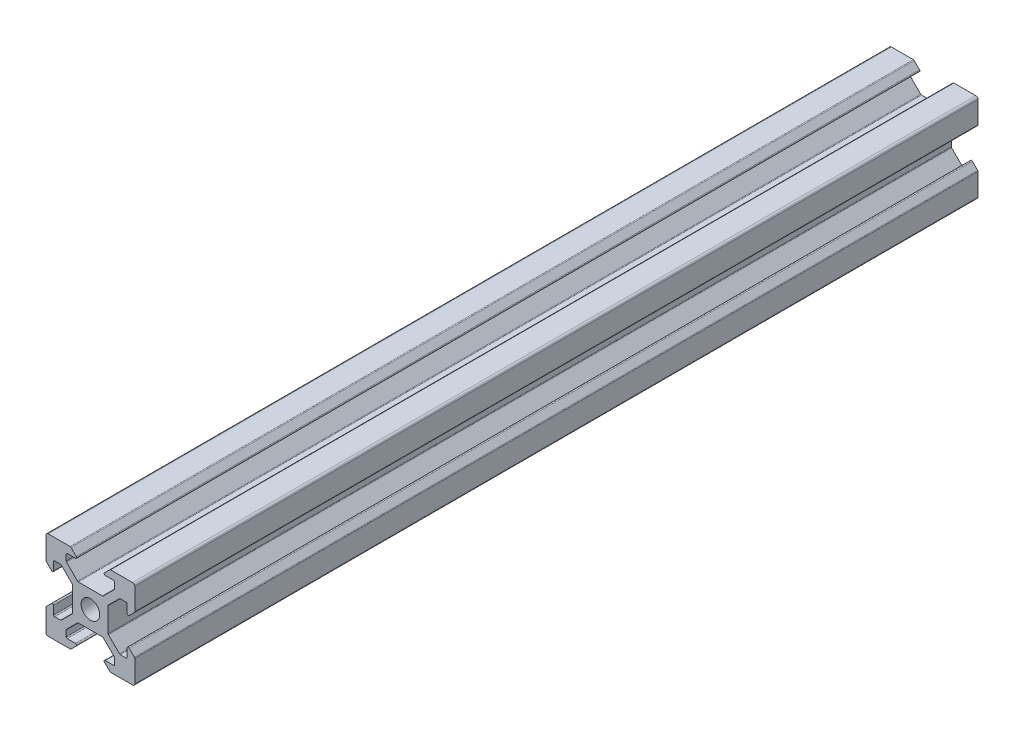
from build123d import *

# Parameters (mm, degrees)
MODEL_R             = 2.1
BOSS_EXTRUDE1_DEPTH = 190


with BuildPart() as part:
    # Model → Boss-Extrude1 (new body)
    with BuildSketch(Plane.XY):
        with BuildLine():
            Line((2012.931211125, 1381.800393717), (2012.931211125, 1378.200393717))
            Line((2012.931211125, 1378.200393717), (2012.931211125, 1377.300429431))
            ThreePointArc((2012.931211125, 1377.300429431), (2012.908374985, 1377.185624401), (2012.843343159, 1377.088297396))
            Line((2012.843343159, 1377.088297396), (2010.378662785, 1374.623617022))
            ThreePointArc((2010.378662785, 1374.623617022), (2010.297556948, 1374.569423834), (2010.20188609, 1374.550393717))
            Line((2010.20188609, 1374.550393717), (2008.881211125, 1374.550393717))
            ThreePointArc((2008.881211125, 1374.550393717), (2008.70443443, 1374.623617022), (2008.631211125, 1374.800393717))
            Line((2008.631211125, 1374.800393717), (2008.631211125, 1376.650393717))
            ThreePointArc((2008.631211125, 1376.650393717), (2008.476881983, 1376.8813636), (2008.20443443, 1376.827170412))
            Line((2008.20443443, 1376.827170412), (2007.01907909, 1375.641815073))
            ThreePointArc((2007.01907909, 1375.641815073), (2006.954047265, 1375.544488069), (2006.931211125, 1375.429683039))
            Line((2006.931211125, 1375.429683039), (2006.931211125, 1370.500393717))
            ThreePointArc((2006.931211125, 1370.500393717), (2007.077657734, 1370.146840327), (2007.431211125, 1370.000393717))
            Line((2007.431211125, 1370.000393717), (2012.360500447, 1370.000393717))
            ThreePointArc((2012.360500447, 1370.000393717), (2012.475305476, 1370.023229857), (2012.572632481, 1370.088261683))
            Line((2012.572632481, 1370.088261683), (2013.75798782, 1371.273617022))
            ThreePointArc((2013.75798782, 1371.273617022), (2013.812181008, 1371.546064575), (2013.581211125, 1371.700393717))
            Line((2013.581211125, 1371.700393717), (2011.731211125, 1371.700393717))
            ThreePointArc((2011.731211125, 1371.700393717), (2011.55443443, 1371.773617022), (2011.481211125, 1371.950393717))
            Line((2011.481211125, 1371.950393717), (2011.481211125, 1373.271068682))
            ThreePointArc((2011.481211125, 1373.271068682), (2011.500241242, 1373.36673954), (2011.55443443, 1373.447845377))
            Line((2011.55443443, 1373.447845377), (2014.033759465, 1375.927170412))
            ThreePointArc((2014.033759465, 1375.927170412), (2014.114865302, 1375.9813636), (2014.21053616, 1376.000393717))
            Line((2014.21053616, 1376.000393717), (2016.470233902, 1376.000393717))
            Line((2016.470233902, 1376.000393717), (2017.392188348, 1376.000393717))
            Line((2017.392188348, 1376.000393717), (2019.65188609, 1376.000393717))
            ThreePointArc((2019.65188609, 1376.000393717), (2019.747556948, 1375.9813636), (2019.828662785, 1375.927170412))
            Line((2019.828662785, 1375.927170412), (2022.30798782, 1373.447845377))
            ThreePointArc((2022.30798782, 1373.447845377), (2022.362181008, 1373.36673954), (2022.381211125, 1373.271068682))
            Line((2022.381211125, 1373.271068682), (2022.381211125, 1371.950393717))
            ThreePointArc((2022.381211125, 1371.950393717), (2022.30798782, 1371.773617022), (2022.131211125, 1371.700393717))
            Line((2022.131211125, 1371.700393717), (2020.281211125, 1371.700393717))
            ThreePointArc((2020.281211125, 1371.700393717), (2020.050241242, 1371.546064575), (2020.10443443, 1371.273617022))
            Line((2020.10443443, 1371.273617022), (2021.289789769, 1370.088261683))
            ThreePointArc((2021.289789769, 1370.088261683), (2021.387116773, 1370.023229857), (2021.501921803, 1370.000393717))
            Line((2021.501921803, 1370.000393717), (2026.431211125, 1370.000393717))
            ThreePointArc((2026.431211125, 1370.000393717), (2026.784764515, 1370.146840327), (2026.931211125, 1370.500393717))
            Line((2026.931211125, 1370.500393717), (2026.931211125, 1375.429683039))
            ThreePointArc((2026.931211125, 1375.429683039), (2026.908374985, 1375.544488069), (2026.843343159, 1375.641815073))
            Line((2026.843343159, 1375.641815073), (2025.65798782, 1376.827170412))
            ThreePointArc((2025.65798782, 1376.827170412), (2025.385540267, 1376.8813636), (2025.231211125, 1376.650393717))
            Line((2025.231211125, 1376.650393717), (2025.231211125, 1374.800393717))
            ThreePointArc((2025.231211125, 1374.800393717), (2025.15798782, 1374.623617022), (2024.981211125, 1374.550393717))
            Line((2024.981211125, 1374.550393717), (2023.66053616, 1374.550393717))
            ThreePointArc((2023.66053616, 1374.550393717), (2023.564865302, 1374.569423834), (2023.483759465, 1374.623617022))
            Line((2023.483759465, 1374.623617022), (2021.00443443, 1377.102942057))
            ThreePointArc((2021.00443443, 1377.102942057), (2020.950241242, 1377.184047894), (2020.931211125, 1377.279718752))
            Line((2020.931211125, 1377.279718752), (2020.931211125, 1379.539416494))
            Line((2020.931211125, 1379.539416494), (2020.931211125, 1380.46137094))
            Line((2020.931211125, 1380.46137094), (2020.931211125, 1382.721068682))
            ThreePointArc((2020.931211125, 1382.721068682), (2020.950241242, 1382.81673954), (2021.00443443, 1382.897845377))
            Line((2021.00443443, 1382.897845377), (2023.483759465, 1385.377170412))
            ThreePointArc((2023.483759465, 1385.377170412), (2023.564865302, 1385.4313636), (2023.66053616, 1385.450393717))
            Line((2023.66053616, 1385.450393717), (2024.981211125, 1385.450393717))
            ThreePointArc((2024.981211125, 1385.450393717), (2025.15798782, 1385.377170412), (2025.231211125, 1385.200393717))
            Line((2025.231211125, 1385.200393717), (2025.231211125, 1383.350393717))
            ThreePointArc((2025.231211125, 1383.350393717), (2025.385540267, 1383.119423834), (2025.65798782, 1383.173617022))
            Line((2025.65798782, 1383.173617022), (2026.843343159, 1384.358972361))
            ThreePointArc((2026.843343159, 1384.358972361), (2026.908374985, 1384.456299366), (2026.931211125, 1384.571104395))
            Line((2026.931211125, 1384.571104395), (2026.931211125, 1389.500393717))
            ThreePointArc((2026.931211125, 1389.500393717), (2026.784764516, 1389.853947108), (2026.431211125, 1390.000393717))
            Line((2026.431211125, 1390.000393717), (2021.501921803, 1390.000393717))
            ThreePointArc((2021.501921803, 1390.000393717), (2021.387116773, 1389.977557577), (2021.289789769, 1389.912525752))
            Line((2021.289789769, 1389.912525752), (2020.10443443, 1388.727170413))
            ThreePointArc((2020.10443443, 1388.727170413), (2020.050241242, 1388.454722859), (2020.281211125, 1388.300393717))
            Line((2020.281211125, 1388.300393717), (2022.131211125, 1388.300393717))
            ThreePointArc((2022.131211125, 1388.300393717), (2022.30798782, 1388.227170413), (2022.381211125, 1388.050393717))
            Line((2022.381211125, 1388.050393717), (2022.381211125, 1386.729718752))
            ThreePointArc((2022.381211125, 1386.729718752), (2022.362181008, 1386.634047894), (2022.30798782, 1386.552942057))
            Line((2022.30798782, 1386.552942057), (2019.828662785, 1384.073617022))
            ThreePointArc((2019.828662785, 1384.073617022), (2019.747556948, 1384.019423834), (2019.65188609, 1384.000393717))
            Line((2019.65188609, 1384.000393717), (2017.392188348, 1384.000393717))
            Line((2017.392188348, 1384.000393717), (2016.470233902, 1384.000393717))
            Line((2016.470233902, 1384.000393717), (2014.21053616, 1384.000393717))
            ThreePointArc((2014.21053616, 1384.000393717), (2014.114865302, 1384.019423834), (2014.033759465, 1384.073617022))
            Line((2014.033759465, 1384.073617022), (2011.55443443, 1386.552942057))
            ThreePointArc((2011.55443443, 1386.552942057), (2011.500241242, 1386.634047894), (2011.481211125, 1386.729718752))
            Line((2011.481211125, 1386.729718752), (2011.481211125, 1388.050393717))
            ThreePointArc((2011.481211125, 1388.050393717), (2011.55443443, 1388.227170413), (2011.731211125, 1388.300393717))
            Line((2011.731211125, 1388.300393717), (2013.581211125, 1388.300393717))
            ThreePointArc((2013.581211125, 1388.300393717), (2013.812181008, 1388.454722859), (2013.75798782, 1388.727170413))
            Line((2013.75798782, 1388.727170413), (2012.572632481, 1389.912525752))
            ThreePointArc((2012.572632481, 1389.912525752), (2012.475305477, 1389.977557577), (2012.360500447, 1390.000393717))
            Line((2012.360500447, 1390.000393717), (2007.431211125, 1390.000393717))
            ThreePointArc((2007.431211125, 1390.000393717), (2007.077657734, 1389.853947108), (2006.931211125, 1389.500393717))
            Line((2006.931211125, 1389.500393717), (2006.931211125, 1384.571104395))
            ThreePointArc((2006.931211125, 1384.571104395), (2006.954047265, 1384.456299366), (2007.019079091, 1384.358972361))
            Line((2007.019079091, 1384.358972361), (2008.20443443, 1383.173617022))
            ThreePointArc((2008.20443443, 1383.173617022), (2008.476881983, 1383.119423834), (2008.631211125, 1383.350393717))
            Line((2008.631211125, 1383.350393717), (2008.631211125, 1385.200393717))
            ThreePointArc((2008.631211125, 1385.200393717), (2008.70443443, 1385.377170412), (2008.881211125, 1385.450393717))
            Line((2008.881211125, 1385.450393717), (2010.20188609, 1385.450393717))
            ThreePointArc((2010.20188609, 1385.450393717), (2010.297556948, 1385.4313636), (2010.378662785, 1385.377170412))
            Line((2010.378662785, 1385.377170412), (2012.843343159, 1382.912490038))
            ThreePointArc((2012.843343159, 1382.912490038), (2012.908374985, 1382.815163033), (2012.931211125, 1382.700358004))
            Line((2012.931211125, 1382.700358004), (2012.931211125, 1381.800393717))
        make_face()
        with Locations((2016.931211125, 1380.000393717)):
            Circle(MODEL_R, mode=Mode.SUBTRACT)
    extrude(amount=BOSS_EXTRUDE1_DEPTH)


solid = part.part
